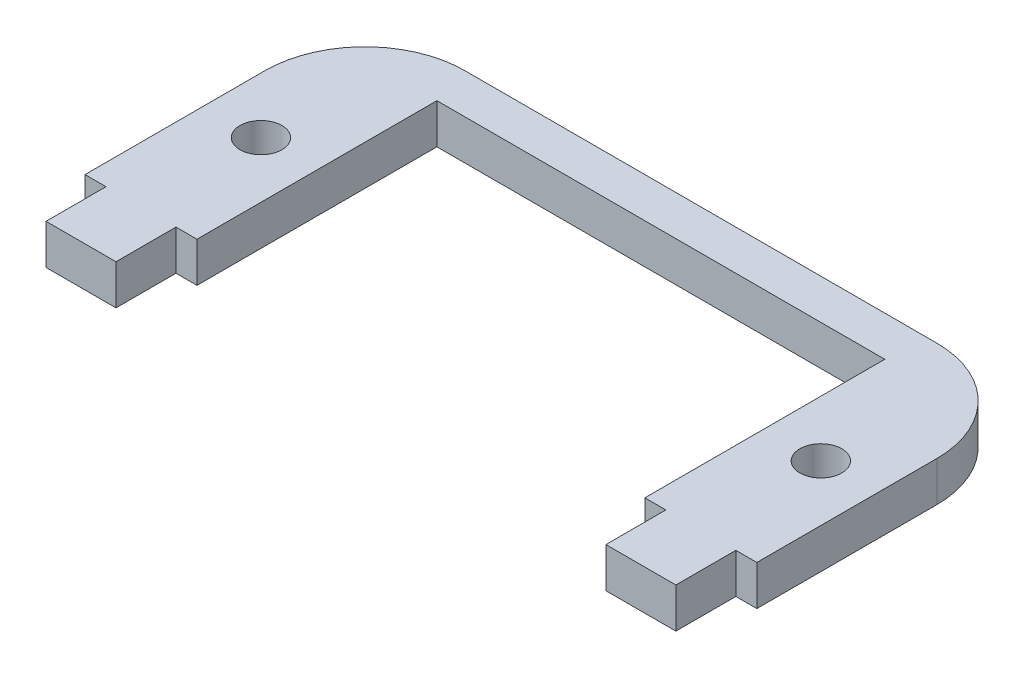
from build123d import *

# Parameters (mm, degrees)
CROQUIS1_R              = 1.05
SALIENTE_EXTRUIR1_DEPTH = 2


with BuildPart() as part:
    # Croquis1 → Saliente-Extruir1 (new body)
    with BuildSketch(Plane(origin=(0, 0, 0), x_dir=(1, 0, 0), z_dir=(0, 1, 0))):
        with BuildLine():
            Line((-11.2, 0), (-11.2, 12))
            Line((-11.2, 12), (11.2, 12))
            Line((11.2, 12), (11.2, 0))
            Line((11.2, 0), (12.25, 0))
            Line((12.25, 0), (12.25, -3))
            Line((12.25, -3), (15.75, -3))
            Line((15.75, -3), (15.75, 0))
            Line((15.75, 0), (16.8, 0))
            Line((16.8, 0), (16.8, 9))
            ThreePointArc((16.8, 9), (15.335533906, 12.535533906), (11.8, 14))
            Line((11.8, 14), (-11.8, 14))
            ThreePointArc((-11.8, 14), (-15.335533906, 12.535533906), (-16.8, 9))
            Line((-16.8, 9), (-16.8, 0))
            Line((-16.8, 0), (-15.75, 0))
            Line((-15.75, 0), (-15.75, -3))
            Line((-15.75, -3), (-12.25, -3))
            Line((-12.25, -3), (-12.25, 0))
            Line((-12.25, 0), (-11.2, 0))
        make_face()
        with Locations(Location((-14, 6, 0), (0, 0, 270))):
            Circle(CROQUIS1_R, mode=Mode.SUBTRACT)
        with Locations(Location((14, 6, 0), (0, 0, 270))):
            Circle(CROQUIS1_R, mode=Mode.SUBTRACT)
    extrude(amount=SALIENTE_EXTRUIR1_DEPTH)


solid = part.part
